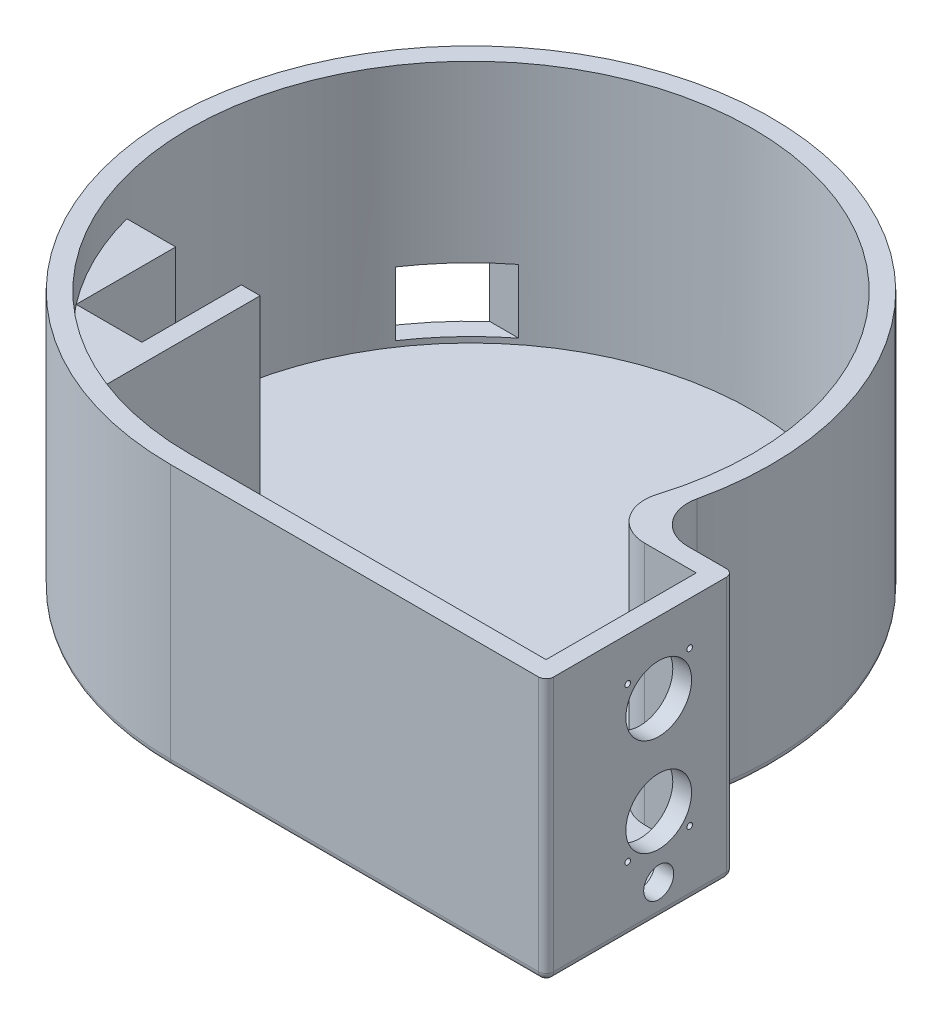
from build123d import *

# Parameters (mm, degrees)
BOSS_EXTRUDE1_DEPTH     = 70
SHELL1_T                = -5
SKETCH3_R               = 8.75
SKETCH3_R_2             = 0.75
SKETCH3_R_3             = 4
CUT_EXTRUDE1_DEPTH      = 5
CUT_EXTRUDE2_REACH      = 147.945
CUT_EXTRUDE2_END_RADIUS = 80
SKETCH4_W               = 17
SKETCH4_H               = 17
SKETCH4_W_2             = 21
SKETCH4_H_2             = 13
CUT_EXTRUDE3_DEPTH      = 146.945195193
CUT_EXTRUDE3_DEPTH_BACK = 146.945195193
SKETCH5_W               = 2.5
SKETCH5_H               = 18
BOSS_EXTRUDE3_DEPTH     = 55
FILLET1_R               = 10
FILLET2_R               = 2


with BuildPart() as part:
    # Sketch1 → Boss-Extrude1 (new body)
    with BuildSketch(Plane(origin=(0, 0, 0), x_dir=(1, 0, 0), z_dir=(0, 1, 0))):
        with BuildLine():
            Line((0, -80), (100, -80))
            Line((100, -80), (100, -30))
            Line((100, -30), (74.161984871, -30))
            ThreePointArc((74.161984871, -30), (-44.72135955, 66.332495807), (0, -80))
        make_face()
    extrude(amount=BOSS_EXTRUDE1_DEPTH)

    # Shell1
    shell1_openings = [part.faces().sort_by_distance(p)[0] for p in [
        (7.618956149, 70, 6.200850369),
    ]]
    offset(amount=SHELL1_T, openings=shell1_openings, kind=Kind.INTERSECTION)

    # Sketch3 → Cut-Extrude1 (cut)
    with BuildSketch(Plane(origin=(100, 0, 0), x_dir=(0, 0, -1), z_dir=(1, 0, 0))):
        with Locations((-50, 25)):
            Circle(SKETCH3_R)
        with Locations((-50, 51)):
            Circle(SKETCH3_R)
        with Locations((-41.75, 58.5)):
            Circle(SKETCH3_R_2)
        with Locations((-41.75, 17.5)):
            Circle(SKETCH3_R_2)
        with Locations((-58.25, 17.5)):
            Circle(SKETCH3_R_2)
        with Locations((-58.25, 58.5)):
            Circle(SKETCH3_R_2)
        with Locations((-50, 8.65)):
            Circle(SKETCH3_R_3)
    extrude(amount=-CUT_EXTRUDE1_DEPTH, mode=Mode.SUBTRACT)

    # Cut-Extrude2: up to this cylinder (the profile starts inside it)
    cut_extrude2_end = Plane(origin=(0, 15, 0), z_dir=(0, -1, 0)) * Cylinder(CUT_EXTRUDE2_END_RADIUS, 456.89, mode=Mode.PRIVATE)
    # Sketch4 → Cut-Extrude2 (cut, up to the surface)
    with BuildSketch(Plane(origin=(0, 0, 0), x_dir=(0, 0, -1), z_dir=(1, 0, 0)), mode=Mode.PRIVATE) as cut_extrude2_sk1:
        with Locations((50.5, 15)):
            Rectangle(SKETCH4_W, SKETCH4_H)
    cut_extrude2_tool1 = extrude(cut_extrude2_sk1.sketch, amount=-CUT_EXTRUDE2_REACH, mode=Mode.PRIVATE) & cut_extrude2_end
    add(cut_extrude2_tool1.solids().sort_by_distance((0, 15, -50.5))[0], mode=Mode.SUBTRACT)
    # Sketch4 → Cut-Extrude2 (cut, up to the surface)
    with BuildSketch(Plane(origin=(0, 0, 0), x_dir=(0, 0, -1), z_dir=(1, 0, 0)), mode=Mode.PRIVATE) as cut_extrude2_sk2:
        with Locations((0, 15)):
            Rectangle(SKETCH4_W_2, SKETCH4_H_2)
    cut_extrude2_tool2 = extrude(cut_extrude2_sk2.sketch, amount=-CUT_EXTRUDE2_REACH, mode=Mode.PRIVATE) & cut_extrude2_end
    add(cut_extrude2_tool2.solids().sort_by_distance((0, 15, 0))[0], mode=Mode.SUBTRACT)

    # Sketch5 → Cut-Extrude3 (cut, two sides: drawn at the far end of the back side and taken through both)
    with BuildSketch(Plane.XY.offset(-CUT_EXTRUDE3_DEPTH_BACK)):
        with Locations((-79.998342826, 15)):
            Rectangle(SKETCH5_W, SKETCH5_H)
    extrude(amount=CUT_EXTRUDE3_DEPTH + CUT_EXTRUDE3_DEPTH_BACK, mode=Mode.SUBTRACT)

    # Sketch6 → Boss-Extrude3 (add)
    with BuildSketch(Plane(origin=(0, 5, 0), x_dir=(1, 0, 0), z_dir=(0, 1, 0))):
        with BuildLine():
            Line((-72.5176701, -19.136026841), (-59.5176701, -19.136026841))
            Line((-59.5176701, -19.136026841), (-59.5176701, -45.636026841))
            Line((-59.5176701, -45.636026841), (-42.0176701, -45.636026841))
            Line((-42.0176701, -45.636026841), (-42.0176701, -19.136026841))
            Line((-42.0176701, -19.136026841), (-37.0176701, -19.136026841))
            Line((-37.0176701, -19.136026841), (-37.0176701, -65.228000892))
            Line((-37.0176701, -65.228000892), (-37.0176701, -67.228000892))
            ThreePointArc((-37.0176701, -67.228000892), (-61.280154536, -47.480406071), (-74.5176701, -19.136026841))
            Line((-74.5176701, -19.136026841), (-72.5176701, -19.136026841))
        make_face()
    extrude(amount=BOSS_EXTRUDE3_DEPTH)

    # Fillet1
    fillet1_edges = [part.edges().sort_by_distance(p)[0] for p in [
        (66.332495807, 37.5, 35),
        (74.161984871, 35, 30),
    ]]
    fillet(fillet1_edges, radius=FILLET1_R)

    # Fillet2
    fillet2_edges = [part.edges().sort_by_distance(p)[0] for p in [
        (-49.888765157, 0, -62.538876798),
        (79.932284274, 0, 26.236095645),
        (93.874821937, 0, 30),
        (100, 0, 55),
        (50, 0, 80),
        (100, 35, 30),
        (100, 35, 80),
    ]]
    fillet(fillet2_edges, radius=FILLET2_R)


solid = part.part
